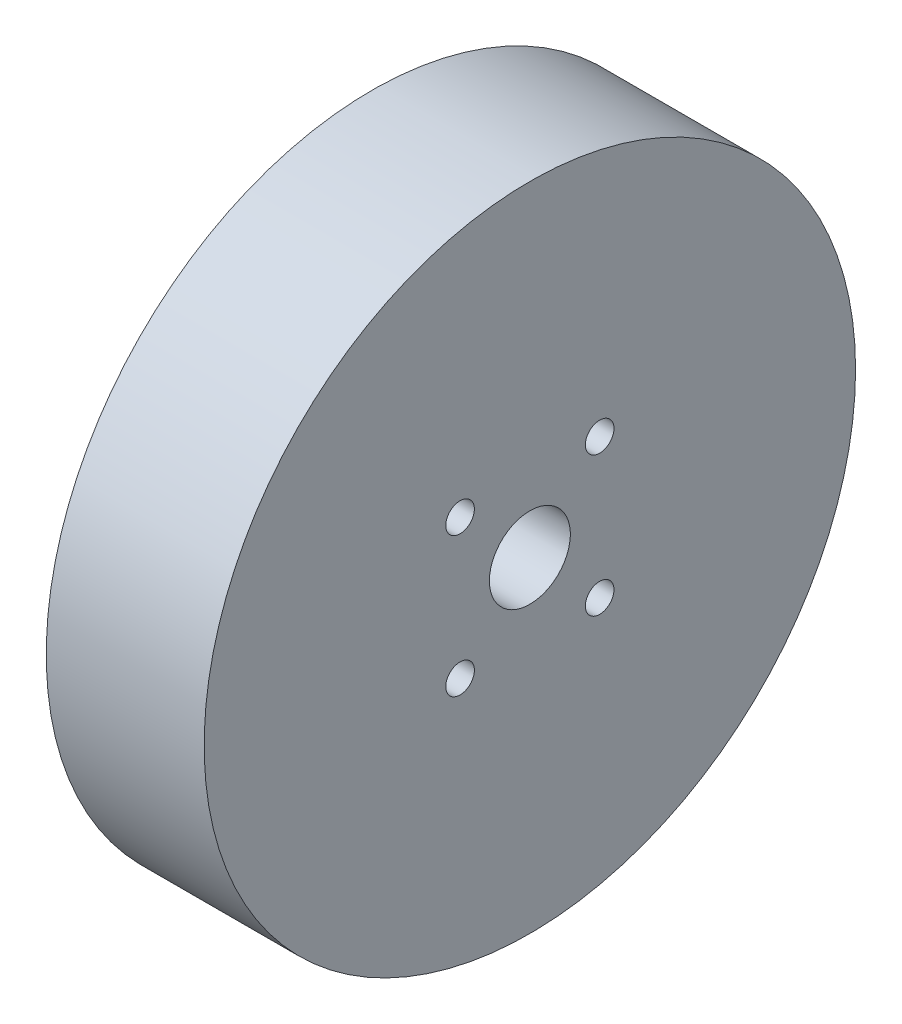
from build123d import *

# Parameters (mm, degrees)
SKETCH_1_R          = 33
EXTRUDE_1_DEPTH     = 16
SKETCH_2_R          = 4.1
SKETCH_2_R_2        = 1.45
CUT_EXTRUDE_1_DEPTH = 16


with BuildPart() as part:
    # 草图1 → 凸台-拉伸1 (new body)
    with BuildSketch(Plane(origin=(0, 0, 0), x_dir=(0, 0, -1), z_dir=(1, 0, 0))):
        Circle(SKETCH_1_R)
    extrude(amount=EXTRUDE_1_DEPTH)

    # 草图2 → 切除-拉伸1 (cut)
    with BuildSketch(Plane.ZY):
        Circle(SKETCH_2_R)
        with Locations((-7.071067812, 7.071067812)):
            Circle(SKETCH_2_R_2)
        with Locations((-7.071067812, -7.071067812)):
            Circle(SKETCH_2_R_2)
        with Locations((7.071067812, -7.071067812)):
            Circle(SKETCH_2_R_2)
        with Locations((7.071067812, 7.071067812)):
            Circle(SKETCH_2_R_2)
    extrude(amount=-CUT_EXTRUDE_1_DEPTH, mode=Mode.SUBTRACT)


solid = part.part
